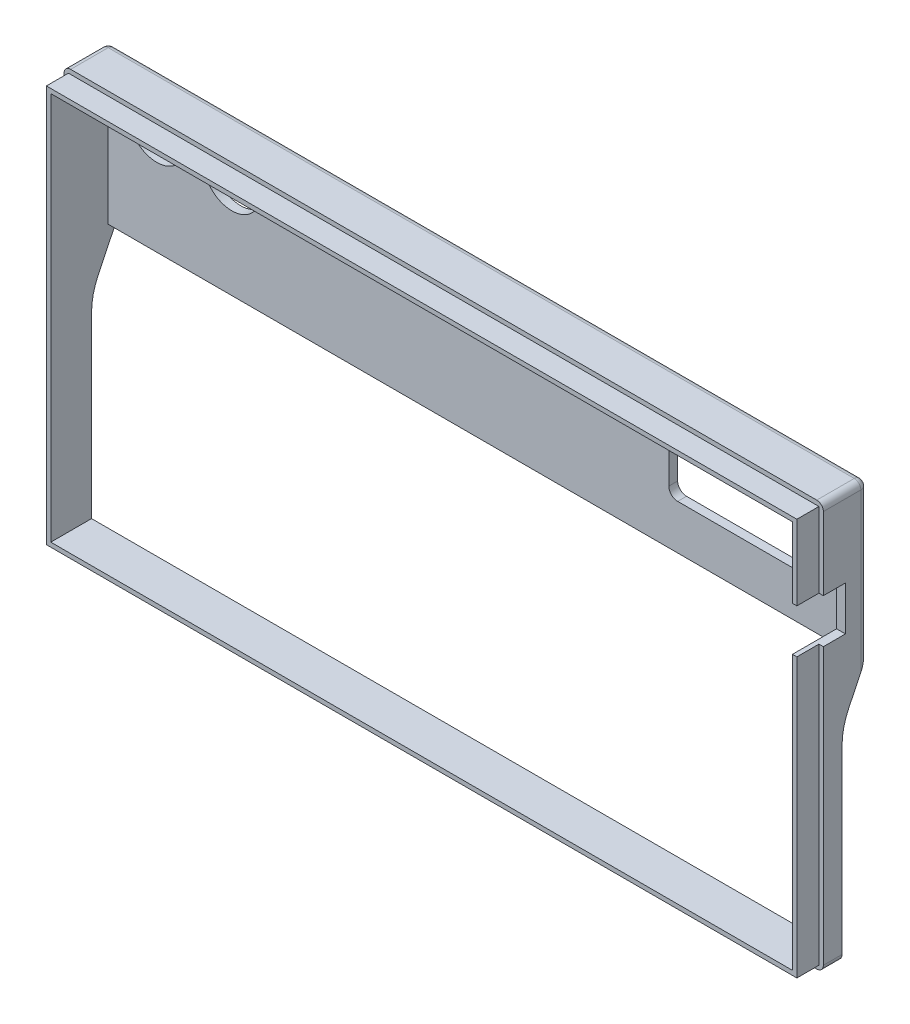
from build123d import *

# Parameters (mm, degrees)
SKETCH_1_W               = 172
SKETCH_1_H               = 92
EXTRUDE_1_DEPTH          = 2
SKETCH_2_W               = 32
SKETCH_2_H               = 22
CUT_EXTRUDE_1_DEPTH      = 2
SKETCH_3_R               = 6.5
CUT_EXTRUDE_2_DEPTH      = 2
SKETCH_4_W               = 172
SKETCH_4_H               = 92
EXTRUDE_3_DEPTH          = 13
SKETCH_5_W               = 168
SKETCH_5_H               = 55.87
CUT_EXTRUDE_3_DEPTH      = 18
CUT_EXTRUDE_4_DEPTH      = 182.789670088
CUT_EXTRUDE_4_DEPTH_BACK = 172
FILLET_1_R               = 15
SKETCH_7_W               = 10
SKETCH_7_H               = 10
CUT_EXTRUDE_5_DEPTH      = 2
CUT_EXTRUDE_6_DEPTH      = 5
FILLET_2_R               = 2
FILLET_3_R               = 1.5


with BuildPart() as part:
    # 草图1 → 凸台-拉伸1 (new body)
    with BuildSketch(Plane.XY):
        with Locations((1.259970458, -10.907680945)):
            Rectangle(SKETCH_1_W, SKETCH_1_H)
    extrude(amount=EXTRUDE_1_DEPTH)

    # 草图2 → 切除-拉伸1 (cut)
    with BuildSketch(Plane(origin=(0, 0, 0), x_dir=(-1, 0, 0), z_dir=(0, 0, -1))):
        with Locations((-60.259970458, 22.092319055)):
            Rectangle(SKETCH_2_W, SKETCH_2_H)
    extrude(amount=-CUT_EXTRUDE_1_DEPTH, mode=Mode.SUBTRACT)

    # 草图3 → 切除-拉伸2 (cut)
    with BuildSketch(Plane(origin=(0, 0, 0), x_dir=(-1, 0, 0), z_dir=(0, 0, -1))):
        with Locations((54.740029542, 24.092319055)):
            Circle(SKETCH_3_R)
        with Locations((71.740029542, 25.092319055)):
            Circle(SKETCH_3_R)
    extrude(amount=-CUT_EXTRUDE_2_DEPTH, mode=Mode.SUBTRACT)

    # 草图4 → 凸台-拉伸3 (add)
    with BuildSketch(Plane.XY.offset(2)):
        with Locations((1.259970458, -10.907680945)):
            Rectangle(SKETCH_4_W, SKETCH_4_H)
        Polygon((-82.740029542, -54.907680945), (-82.740029542, 33.092319055), (44.259970458, 33.092319055), (76.259970458, 33.092319055), (85.259970458, 33.092319055), (85.259970458, -54.907680945), align=None, mode=Mode.SUBTRACT)
    extrude(amount=EXTRUDE_3_DEPTH)

    # 草图5 → 切除-拉伸3 (cut)
    with BuildSketch(Plane(origin=(0, 0, 0), x_dir=(-1, 0, 0), z_dir=(0, 0, -1))):
        with Locations((-1.259970458, -26.972680945)):
            Rectangle(SKETCH_5_W, SKETCH_5_H)
    extrude(amount=-CUT_EXTRUDE_3_DEPTH, mode=Mode.SUBTRACT)

    # 草图6 → 切除-拉伸4 (cut, two sides: drawn at the far end of the back side and taken through both)
    with BuildSketch(Plane(origin=(87.259970458, 0, 0), x_dir=(0, 0, -1), z_dir=(1, 0, 0)).offset(-CUT_EXTRUDE_4_DEPTH_BACK)):
        Polygon((84.64151075, 176.551763032), (0, 0.962319055), (-5.76238744, -10.991796575), (-5.76238744, -56.907680945), (-5.76238744, -251.832892702), (375.68654555, -332.33173887), (466.09044374, 96.052916865), align=None)
    extrude(amount=CUT_EXTRUDE_4_DEPTH + CUT_EXTRUDE_4_DEPTH_BACK, mode=Mode.SUBTRACT)

    # 圆角1
    fillet_1_edges = [part.edges().sort_by_distance(p)[0] for p in [
        (86.259970458, -10.991796575, 5.76238744),
        (-83.740029542, -10.991796575, 5.76238744),
    ]]
    fillet(fillet_1_edges, radius=FILLET_1_R)

    # 草图7 → 切除-拉伸5 (cut)
    with BuildSketch(Plane(origin=(87.259970458, 0, 0), x_dir=(0, 0, -1), z_dir=(1, 0, 0))):
        with Locations((-10, 12.092319055)):
            Rectangle(SKETCH_7_W, SKETCH_7_H)
    extrude(amount=-CUT_EXTRUDE_5_DEPTH, mode=Mode.SUBTRACT)

    # 草图8 → 切除-拉伸6 (cut)
    with BuildSketch(Plane.XY.offset(15)):
        Polygon((-83.740029542, -55.907680945), (-83.740029542, 34.092319055), (86.259970458, 34.092319055), (86.259970458, 17.092319055), (87.259970458, 17.092319055), (87.259970458, 35.092319055), (-84.740029542, 35.092319055), (-84.740029542, -56.907680945), (87.259970458, -56.907680945), (87.259970458, 7.092319055), (86.259970458, 7.092319055), (86.259970458, -55.907680945), align=None)
    extrude(amount=-CUT_EXTRUDE_6_DEPTH, mode=Mode.SUBTRACT)

    # 圆角2
    fillet_2_edges = [part.edges().sort_by_distance(p)[0] for p in [
        (76.259970458, 11.092319055, 1),
        (76.259970458, 33.092319055, 1),
        (44.259970458, 33.092319055, 1),
        (44.259970458, 11.092319055, 1),
    ]]
    fillet(fillet_2_edges, radius=FILLET_2_R)

    # 圆角3
    fillet_3_edges = [part.edges().sort_by_distance(p)[0] for p in [
        (-84.740029542, 35.092319055, 5),
        (87.259970458, 35.092319055, 5),
        (87.259970458, -56.907680945, 7.88119372),
        (-84.740029542, -56.907680945, 7.88119372),
        (1.259970458, 35.092319055, 0),
        (-84.740029542, 18.027319055, 0),
        (87.259970458, 18.027319055, 0),
    ]]
    fillet(fillet_3_edges, radius=FILLET_3_R)


solid = part.part
